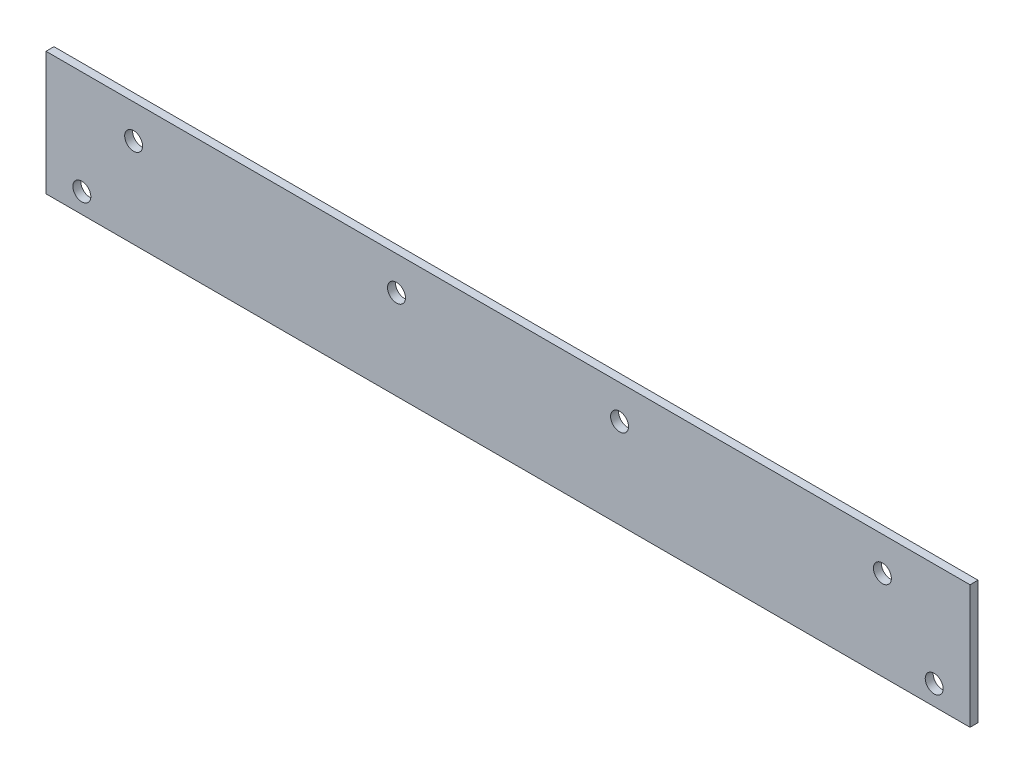
from build123d import *

# Parameters (mm, degrees)
SKETCH_1_W      = 232
SKETCH_1_H      = 31
SKETCH_1_R      = 2.25
EXTRUDE_1_DEPTH = 2


with BuildPart() as part:
    # Эскиз1 → Вытянуть1 (new body)
    with BuildSketch(Plane.XY):
        Rectangle(SKETCH_1_W, SKETCH_1_H)
        with Locations((-28, 7)):
            Circle(SKETCH_1_R, mode=Mode.SUBTRACT)
        with Locations((28, 7)):
            Circle(SKETCH_1_R, mode=Mode.SUBTRACT)
        with Locations((-94, 7)):
            Circle(SKETCH_1_R, mode=Mode.SUBTRACT)
        with Locations(Location((94, 7, 0), (0, 0, 180))):
            Circle(SKETCH_1_R, mode=Mode.SUBTRACT)
        with Locations((-107, -10.5)):
            Circle(SKETCH_1_R, mode=Mode.SUBTRACT)
        with Locations((107, -10.5)):
            Circle(SKETCH_1_R, mode=Mode.SUBTRACT)
    extrude(amount=EXTRUDE_1_DEPTH)


solid = part.part
